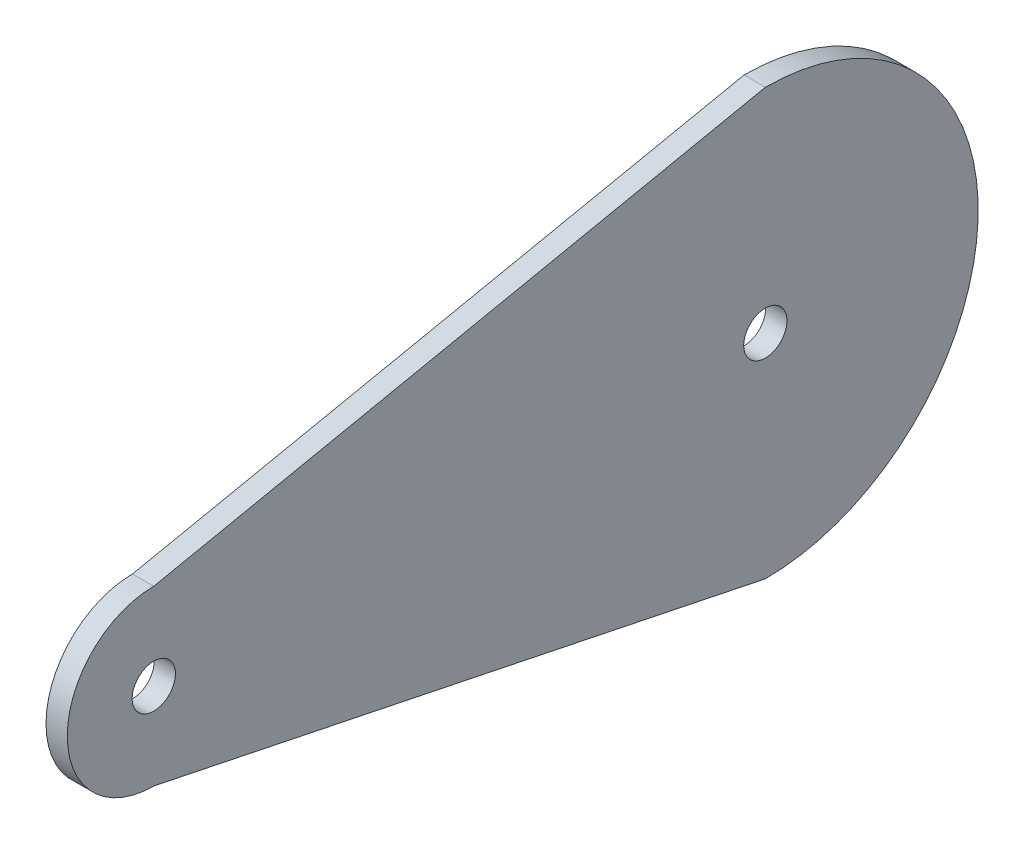
from build123d import *

# Parameters (mm, degrees)
SKETCH1_R           = 2.580823706
BOSS_EXTRUDE1_DEPTH = 2.54


with BuildPart() as part:
    # Sketch1 → Boss-Extrude1 (new body)
    with BuildSketch(Plane(origin=(0, 0, 0), x_dir=(0, 0, -1), z_dir=(1, 0, 0))):
        with BuildLine():
            ThreePointArc((0, 10.323294823), (-10.323294823, 0), (0, -10.323294823))
            Line((0, -10.323294823), (72.9742, -25.4))
            ThreePointArc((72.9742, -25.4), (98.3742, 0), (72.9742, 25.4))
            Line((72.9742, 25.4), (0, 10.323294823))
        make_face()
        Circle(SKETCH1_R, mode=Mode.SUBTRACT)
        with Locations((72.9742, 0)):
            Circle(SKETCH1_R, mode=Mode.SUBTRACT)
    extrude(amount=BOSS_EXTRUDE1_DEPTH)


solid = part.part
